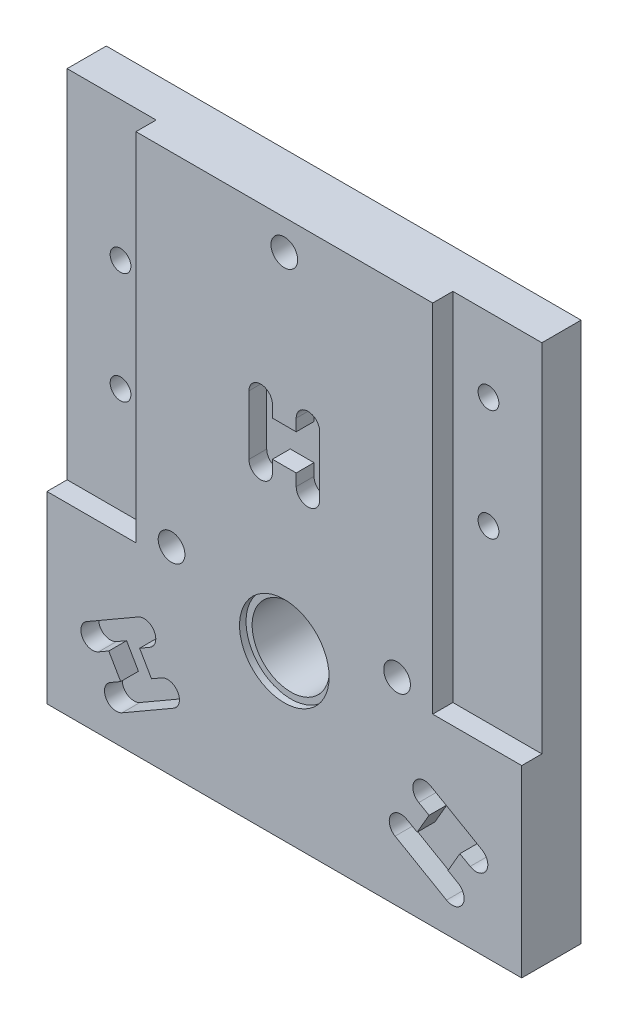
from build123d import *

# Parameters (mm, degrees)
SKETCH1_W           = 80
SKETCH1_H           = 91
BOSS_EXTRUDE1_DEPTH = 10
SKETCH2_R           = 6.525
CUT_EXTRUDE1_DEPTH  = 76.543960712
SKETCH3_R           = 7.55
CUT_EXTRUDE2_DEPTH  = 1.1
CUT_EXTRUDE3_DEPTH  = 3
CIRPATTERN1_COUNT   = 3
SKETCH5_R           = 2.25
CUT_EXTRUDE4_DEPTH  = 76.543960712
SKETCH6_W           = 15
SKETCH6_H           = 60
CUT_EXTRUDE5_DEPTH  = 3.4
SKETCH7_R           = 1.75
CUT_EXTRUDE6_DEPTH  = 76.169475188


with BuildPart() as part:
    # Sketch1 → Boss-Extrude1 (new body)
    with BuildSketch(Plane.XY):
        with Locations((0, 17.8)):
            Rectangle(SKETCH1_W, SKETCH1_H)
    extrude(amount=BOSS_EXTRUDE1_DEPTH)

    # Sketch2 → Cut-Extrude1 (cut, through all)
    with BuildSketch(Plane.XY.offset(10)):
        Circle(SKETCH2_R)
    extrude(amount=-CUT_EXTRUDE1_DEPTH, mode=Mode.SUBTRACT)

    # Sketch3 → Cut-Extrude2 (cut)
    with BuildSketch(Plane.XY.offset(10)):
        Circle(SKETCH3_R)
    extrude(amount=-CUT_EXTRUDE2_DEPTH, mode=Mode.SUBTRACT)

    # Sketch4 → Cut-Extrude3 (cut)
    with BuildSketch(Plane.XY.offset(10)):
        with BuildLine():
            Line((-2, 35), (-2, 33))
            Line((-2, 33), (2, 33))
            Line((2, 33), (2, 35))
            ThreePointArc((2, 35), (3.9825, 36.9825), (5.965, 35))
            Line((5.965, 35), (5.965, 25))
            ThreePointArc((5.965, 25), (3.9825, 23.0175), (2, 25))
            Line((2, 25), (2, 27))
            Line((2, 27), (-2, 27))
            Line((-2, 27), (-2, 25))
            ThreePointArc((-2, 25), (-3.9825, 23.0175), (-5.965, 25))
            Line((-5.965, 25), (-5.965, 35))
            ThreePointArc((-5.965, 35), (-3.9825, 36.9825), (-2, 35))
        make_face()
    cut_extrude3 = extrude(amount=-CUT_EXTRUDE3_DEPTH, mode=Mode.SUBTRACT)

    # CirPattern1: Cut-Extrude3 ×3 about axis
    cirpattern1_axis = Axis((0, 0, 0), (0, 0, 1))
    for i in range(1, CIRPATTERN1_COUNT):
        add(cut_extrude3.rotate(cirpattern1_axis, i * 360 / CIRPATTERN1_COUNT), mode=Mode.SUBTRACT)

    # Sketch5 → Cut-Extrude4 (cut, through all)
    with BuildSketch(Plane.XY.offset(10)):
        with Locations((-19, 5.7)):
            Circle(SKETCH5_R)
        with Locations((19, 5.7)):
            Circle(SKETCH5_R)
        with Locations((0, 58.2)):
            Circle(SKETCH5_R)
    extrude(amount=-CUT_EXTRUDE4_DEPTH, mode=Mode.SUBTRACT)

    # Sketch6 → Cut-Extrude5 (cut)
    with BuildSketch(Plane.XY.offset(10)):
        with Locations((-32.5, 33.3)):
            Rectangle(SKETCH6_W, SKETCH6_H)
        with Locations((32.5, 33.3)):
            Rectangle(SKETCH6_W, SKETCH6_H)
    extrude(amount=-CUT_EXTRUDE5_DEPTH, mode=Mode.SUBTRACT)

    # Sketch7 → Cut-Extrude6 (cut, through all)
    with BuildSketch(Plane.XY.offset(6.6)):
        with Locations((-31, 21.075)):
            Circle(SKETCH7_R)
        with Locations((-31, 39.825)):
            Circle(SKETCH7_R)
        with Locations((31, 32.075)):
            Circle(SKETCH7_R)
        with Locations((31, 50.825)):
            Circle(SKETCH7_R)
    extrude(amount=-CUT_EXTRUDE6_DEPTH, mode=Mode.SUBTRACT)


solid = part.part
